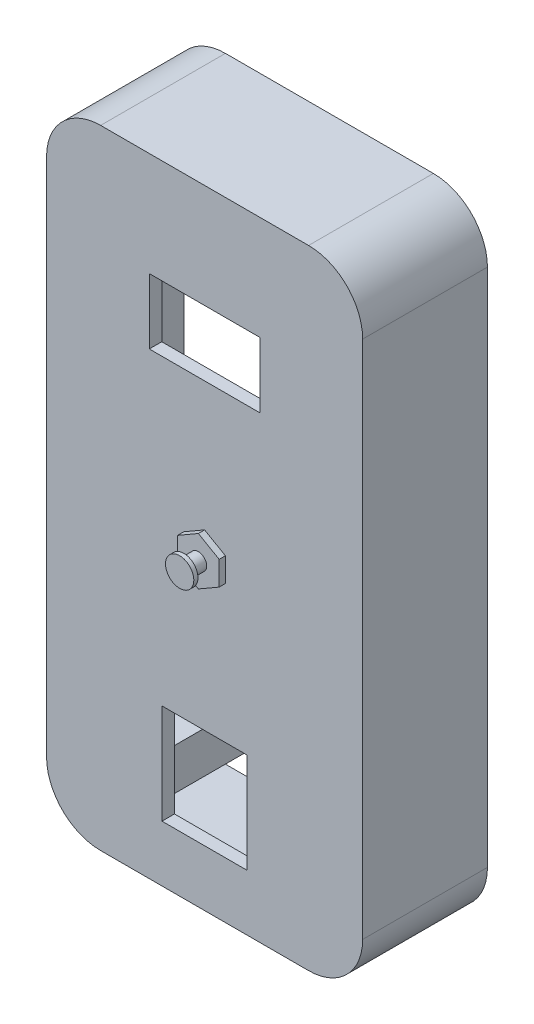
from build123d import *

# Parameters (mm, degrees)
BOSS_EXTRUDE1_DEPTH = 30
BOSS_EXTRUDE2_DEPTH = 3
SKETCH7_R           = 3.4
SKETCH7_W           = 26.6
SKETCH7_H           = 15.7
SKETCH7_W_2         = 20.5
SKETCH7_H_2         = 24
CUT_EXTRUDE1_DEPTH  = 3
SKETCH8_W           = 10
SKETCH8_H           = 10
BOSS_EXTRUDE3_DEPTH = 27
SKETCH9_R           = 3
CUT_EXTRUDE2_DEPTH  = 20
SKETCH10_W          = 12.5
SKETCH10_H          = 18.5
CUT_EXTRUDE3_DEPTH  = 10
BOSS_EXTRUDE4_DEPTH = 1.5
SKETCH14_R          = 2
BOSS_EXTRUDE5_DEPTH = 5
BOSS_EXTRUDE6_START = 1
SKETCH15_R          = 3.4
BOSS_EXTRUDE6_DEPTH = 1


with BuildPart() as part:
    # Sketch1 → Boss-Extrude1 (new body)
    with BuildSketch(Plane.XY):
        with BuildLine():
            Line((-25, 75.5), (25, 75.5))
            ThreePointArc((25, 75.5), (34.192388155, 71.692388155), (38, 62.5))
            Line((38, 62.5), (38, -62.5))
            ThreePointArc((38, -62.5), (34.192388155, -71.692388155), (25, -75.5))
            Line((25, -75.5), (-25, -75.5))
            ThreePointArc((-25, -75.5), (-34.192388155, -71.692388155), (-38, -62.5))
            Line((-38, -62.5), (-38, 62.5))
            ThreePointArc((-38, 62.5), (-34.192388155, 71.692388155), (-25, 75.5))
        make_face()
        with BuildLine():
            Line((-25, 72.5), (25, 72.5))
            ThreePointArc((25, 72.5), (32.071067812, 69.571067812), (35, 62.5))
            Line((35, 62.5), (35, -62.5))
            ThreePointArc((35, -62.5), (32.071067812, -69.571067812), (25, -72.5))
            Line((25, -72.5), (-25, -72.5))
            ThreePointArc((-25, -72.5), (-32.071067812, -69.571067812), (-35, -62.5))
            Line((-35, -62.5), (-35, 62.5))
            ThreePointArc((-35, 62.5), (-32.071067812, 69.571067812), (-25, 72.5))
        make_face(mode=Mode.SUBTRACT)
    extrude(amount=-BOSS_EXTRUDE1_DEPTH)

    # Sketch6 → Boss-Extrude2 (add)
    with BuildSketch(Plane.XY):
        with BuildLine():
            Line((-23, -75.5), (23, -75.5))
            ThreePointArc((23, -75.5), (33.606601718, -71.106601718), (38, -60.5))
            Line((38, -60.5), (38, 60.5))
            ThreePointArc((38, 60.5), (33.606601718, 71.106601718), (23, 75.5))
            Line((23, 75.5), (-23, 75.5))
            ThreePointArc((-23, 75.5), (-33.606601718, 71.106601718), (-38, 60.5))
            Line((-38, 60.5), (-38, -60.5))
            ThreePointArc((-38, -60.5), (-33.606601718, -71.106601718), (-23, -75.5))
        make_face()
    extrude(amount=-BOSS_EXTRUDE2_DEPTH)

    # Sketch7 → Cut-Extrude1 (cut)
    with BuildSketch(Plane.XY):
        with Locations((0, -2)):
            Circle(SKETCH7_R)
        with Locations((0, 42.65)):
            Rectangle(SKETCH7_W, SKETCH7_H)
        with Locations((0, -50)):
            Rectangle(SKETCH7_W_2, SKETCH7_H_2)
    extrude(amount=-CUT_EXTRUDE1_DEPTH, mode=Mode.SUBTRACT)

    # Sketch8 → Boss-Extrude3 (add)
    with BuildSketch(Plane(origin=(0, 0, -3), x_dir=(-1, 0, 0), z_dir=(0, 0, -1))):
        with Locations((-25, 62.5)):
            Rectangle(SKETCH8_W, SKETCH8_H)
        with Locations((25, 62.5)):
            Rectangle(SKETCH8_W, SKETCH8_H)
        with Locations((25, -62.5)):
            Rectangle(SKETCH8_W, SKETCH8_H)
        with Locations((-25, -62.5)):
            Rectangle(SKETCH8_W, SKETCH8_H)
    extrude(amount=BOSS_EXTRUDE3_DEPTH)

    # Sketch9 → Cut-Extrude2 (cut)
    with BuildSketch(Plane(origin=(0, 0, -30), x_dir=(-1, 0, 0), z_dir=(0, 0, -1))):
        with Locations((-25, 62.5)):
            Circle(SKETCH9_R)
        with Locations((25, 62.5)):
            Circle(SKETCH9_R)
        with BuildLine():
            Line((-25.016555193, -65.499954321), (-24.983444807, -65.499954321))
            ThreePointArc((-24.983444807, -65.499954321), (-22.872834565, -64.615459102), (-22, -62.5))
            ThreePointArc((-22, -62.5), (-27.115459102, -60.372834565), (-25.016555193, -65.499954321))
        make_face()
        with Locations((25, -62.5)):
            Circle(SKETCH9_R)
    extrude(amount=-CUT_EXTRUDE2_DEPTH, mode=Mode.SUBTRACT)

    # Sketch10 → Cut-Extrude3 (cut)
    with BuildSketch(Plane.ZY.offset(38)):
        with Locations((-16.25, 34.886787821)):
            Rectangle(SKETCH10_W, SKETCH10_H)
    extrude(amount=-CUT_EXTRUDE3_DEPTH, mode=Mode.SUBTRACT)

    # Sketch12 → Boss-Extrude4 (add)
    with BuildSketch(Plane.XY):
        Polygon((5, -4.886751346), (5, 0.886751346), (0, 3.773502692), (-5, 0.886751346), (-5, -4.886751346), (0, -7.773502692), align=None)
    extrude(amount=BOSS_EXTRUDE4_DEPTH)

    # Sketch14 → Boss-Extrude5 (add)
    with BuildSketch(Plane.XY):
        with Locations((0, -2)):
            Circle(SKETCH14_R)
    extrude(amount=BOSS_EXTRUDE5_DEPTH)

    # Sketch15 → Boss-Extrude6 (add)
    with BuildSketch(Plane.XY.offset(5).offset(BOSS_EXTRUDE6_START)):
        with Locations((0, -2)):
            Circle(SKETCH15_R)
    extrude(amount=-BOSS_EXTRUDE6_DEPTH)


solid = part.part
